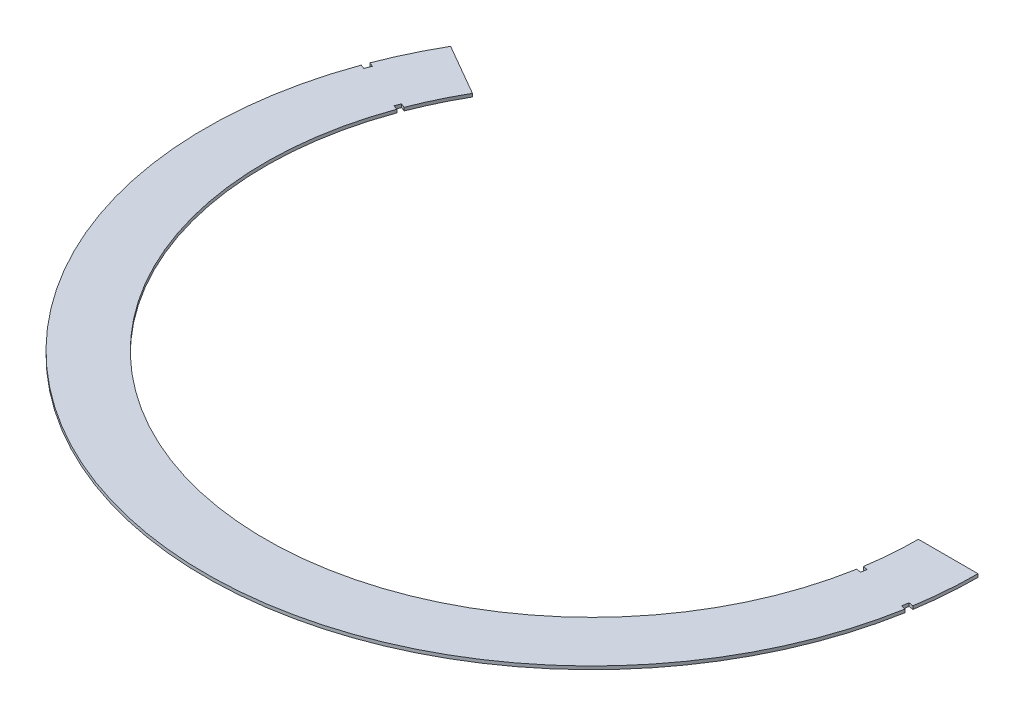
from build123d import *

# Parameters (mm, degrees)
BOSS_EXTRUDE1_DEPTH = 0.7
CUT_EXTRUDE1_DEPTH  = 120.107123213
BOSS_EXTRUDE2_DEPTH = 0.7


with BuildPart() as part:
    # Sketch3 → Boss-Extrude1 (new body)
    with BuildSketch(Plane(origin=(0, 0, 0), x_dir=(1, 0, 0), z_dir=(0, 1, 0))):
        with BuildLine():
            Line((-61.678329258, 35.61), (-72.936659507, 42.11))
            ThreePointArc((-72.936659507, 42.11), (-21.797739979, -81.35027309), (84.22, 0))
            Line((84.22, 0), (71.22, 0))
            ThreePointArc((71.22, 0), (-18.433092392, -68.793237348), (-61.678329258, 35.61))
        make_face()
    extrude(amount=BOSS_EXTRUDE1_DEPTH)

    # Sketch5 → Cut-Extrude1 (cut, through all)
    with BuildSketch(Plane(origin=(0, 0, 0), x_dir=(1, 0, 0), z_dir=(0, 1, 0))):
        Polygon((-66.489597975, 25.522965367), (-80.493304373, 30.89848461), (-81.020297764, 29.488976758), (-66.924908452, 24.358674608), align=None)
    cut_extrude1 = extrude(amount=CUT_EXTRUDE1_DEPTH, mode=Mode.SUBTRACT)


with BuildPart() as cut_extrude1_piece_1:
    # of the separate pieces the step leaves, piece 1, a body of its own (cut_extrude1_pieces)
    add(part.part.solids().sort_by_distance((84.22, 0, 0))[0])



with BuildPart() as cut_extrude1_piece_2:
    # of the separate pieces the step leaves, piece 2, a body of its own (cut_extrude1_pieces)
    add(part.part.solids().sort_by_distance((-72.936659507, 0, -42.11))[0])


with BuildPart() as cut_extrude1_piece_1_1:
    add(cut_extrude1_piece_1.part)

    add(cut_extrude1_piece_2.part)  # Boss-Extrude2 merges Cut-Extrude1 piece 2
    # Sketch6 → Boss-Extrude2 (add)
    with BuildSketch(Plane(origin=(0, 0, 0), x_dir=(1, 0, 0), z_dir=(0, 1, 0))):
        Polygon((-77.692563093, 29.823380761), (-67.423178402, 25.881333316), (-67.943747449, 24.525204583), (-78.213132141, 28.467252028), align=None)
    boss_extrude2 = extrude(amount=BOSS_EXTRUDE2_DEPTH)

    # Mirror1: Cut-Extrude1, Boss-Extrude2 across plane
    add(cut_extrude1.mirror(Plane(origin=(0, 0, 0), x_dir=(-0.25881904510251774, 0, 0.9659258262890691), z_dir=(0.9659258262890692, 0, 0.25881904510251774))), mode=Mode.SUBTRACT)
    add(boss_extrude2.mirror(Plane(origin=(0, 0, 0), x_dir=(-0.25881904510251774, 0, 0.9659258262890691), z_dir=(0.9659258262890692, 0, 0.25881904510251774))))


solid = cut_extrude1_piece_1_1.part
